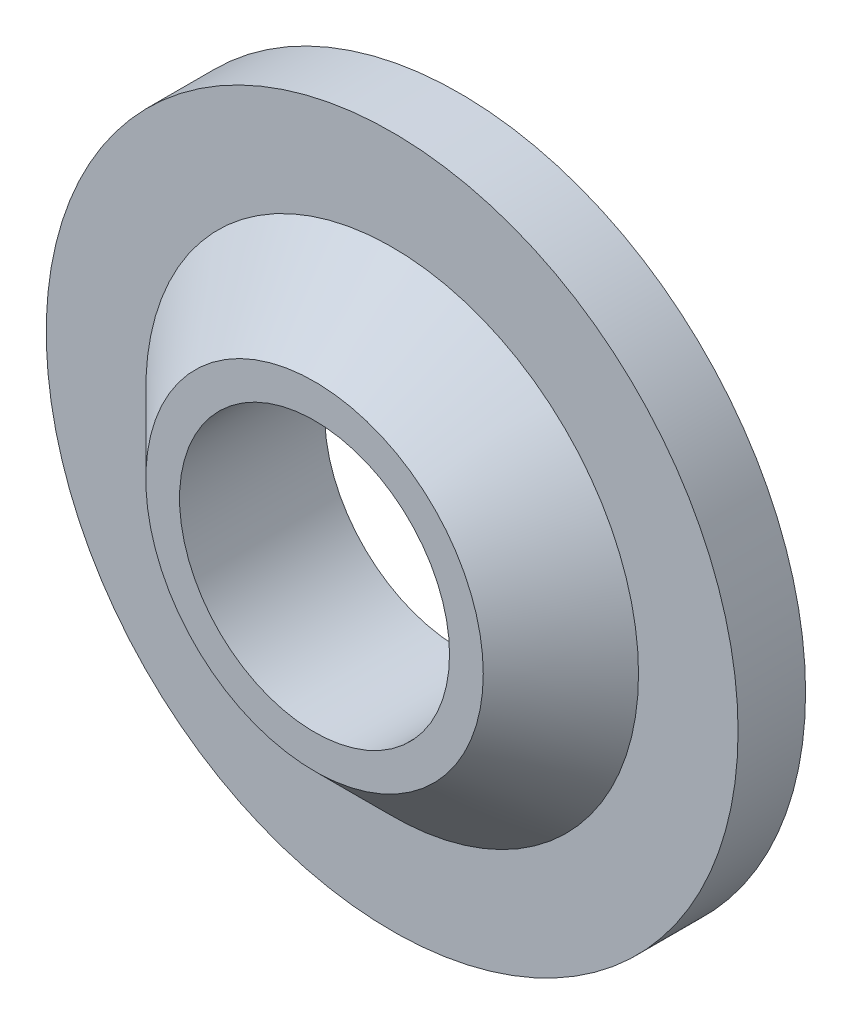
from build123d import *


with BuildPart() as part:
    # Sketch1 → Revolve1 (revolve)
    with BuildSketch(Plane(origin=(0, 0, 0), x_dir=(1, 0, 0), z_dir=(0, 1, 0)), mode=Mode.PRIVATE) as revolve1_sk:
        Polygon((-10.25, 0), (-4, 0), (-4, -4.3), (-5, -4.3), (-7.3, -2), (-10.25, -2), align=None)
    revolve(revolve1_sk.sketch.rotate(Axis((0, 0, 37.801712406), (0, 0, -1)), 180), axis=Axis((0, 0, 37.801712406), (0, 0, -1)))


solid = part.part
